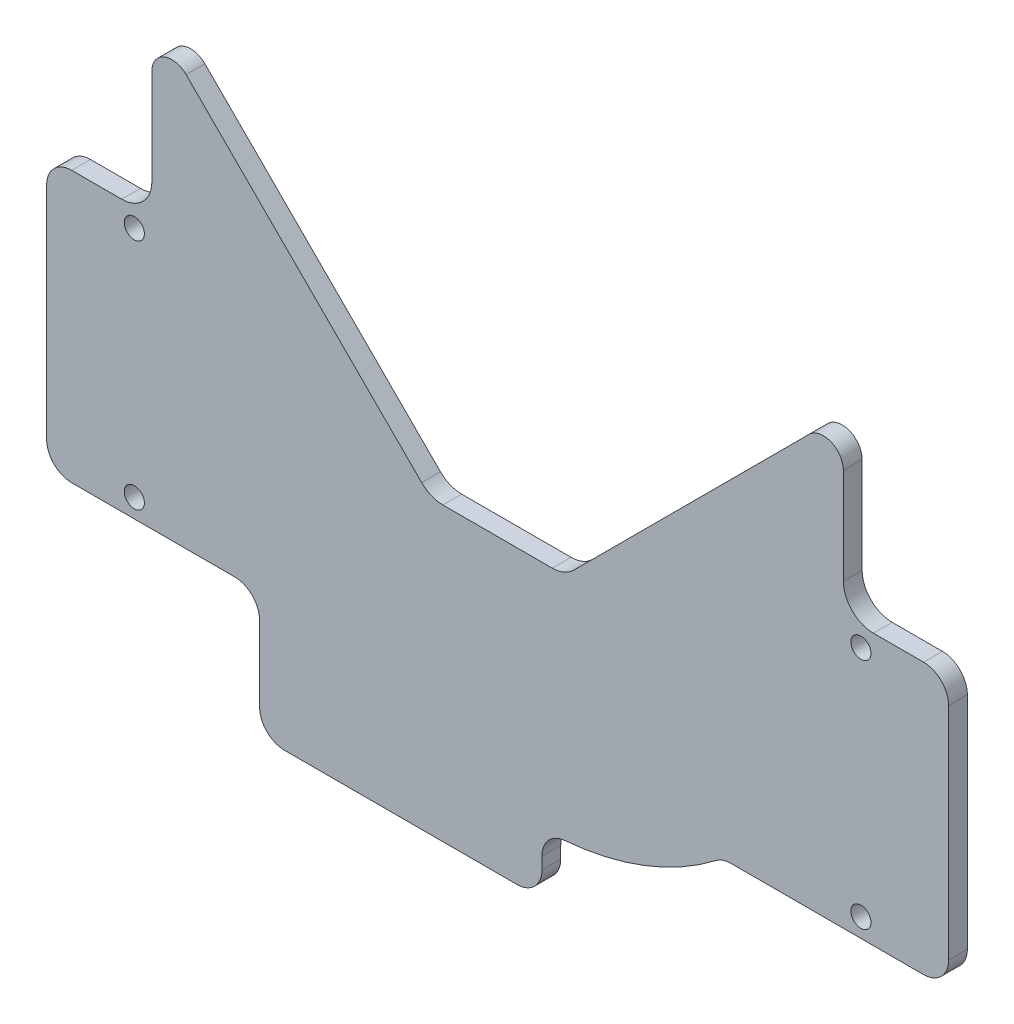
from build123d import *

# Parameters (mm, degrees)
SKETCH2_W                  = 228.6
SKETCH2_H                  = 165.1
BOSS_EXTRUDE1_DEPTH        = 4.7625
F_1_2_0_5_DIAMETER_HOLE1_D = 25.4
SKETCH7_R                  = 66.675
CUT_EXTRUDE4_DEPTH         = 169.123203057
FILLET1_R                  = 6.35
CUT_EXTRUDE5_DEPTH         = 169.123203057
FILLET2_R                  = 6.35
SKETCH9_R                  = 2.5527
CUT_EXTRUDE6_DEPTH         = 149.980700263


with BuildPart() as part:
    # Sketch2 → Boss-Extrude1 (new body)
    with BuildSketch(Plane.XY):
        with Locations((0, 40.65)):
            Rectangle(SKETCH2_W, SKETCH2_H)
    extrude(amount=BOSS_EXTRUDE1_DEPTH)

    # 1/2 (0.5) Diameter Hole1 (through all)
    with Locations(Plane.XY.offset(4.7625)):
        with Locations((-38.227, 85.227), (38.227, 85.227), (11.2268, 45.984)):
            Hole(F_1_2_0_5_DIAMETER_HOLE1_D / 2)

    # Sketch7 → Cut-Extrude4 (cut, through all)
    with BuildSketch(Plane(origin=(0, 0, 0), x_dir=(-1, 0, 0), z_dir=(0, 0, -1))):
        with Locations((0, 180.35)):
            Circle(SKETCH7_R)
    extrude(amount=-CUT_EXTRUDE4_DEPTH, mode=Mode.SUBTRACT)

    # Fillet1
    fillet1_edges = [part.edges().sort_by_distance(p)[0] for p in [
        (-114.3, -41.9, 2.38125),
        (114.3, -41.9, 2.38125),
        (114.3, 123.2, 2.38125),
        (-114.3, 123.2, 2.38125),
    ]]
    fillet(fillet1_edges, radius=FILLET1_R)

    # Sketch8 → Cut-Extrude5 (cut, through all)
    with BuildSketch(Plane.XY.offset(4.7625)):
        with BuildLine():
            Line((-107.95, -41.9), (-60.325, -41.9))
            Line((-60.325, -41.9), (-60.325, -10.15))
            Line((-60.325, -10.15), (-114.3, -10.15))
            Line((-114.3, -10.15), (-114.3, -35.55))
            ThreePointArc((-114.3, -35.55), (-112.440128061, -40.040128061), (-107.95, -41.9))
        make_face()
        with BuildLine():
            Line((11.2395, -41.9), (11.2395, -26.403482524))
            ThreePointArc((11.2395, -26.403482524), (35.494289217, -22.219180967), (56.945117879, -10.15))
            Line((56.945117879, -10.15), (114.3, -10.15))
            Line((114.3, -10.15), (114.3, -35.55))
            ThreePointArc((114.3, -35.55), (112.440128061, -40.040128061), (107.95, -41.9))
            Line((107.95, -41.9), (11.2395, -41.9))
        make_face()
        with BuildLine():
            Line((-114.3, 58.43), (-95.25, 58.43))
            ThreePointArc((-95.25, 58.43), (-89.861846327, 60.661846327), (-87.63, 66.05))
            Line((-87.63, 66.05), (-87.63, 90.356249112))
            ThreePointArc((-87.63, 90.356249112), (-84.494031836, 95.049557138), (-78.957897552, 93.948351561))
            Line((-78.957897552, 93.948351561), (-19.257909794, 34.248363803))
            ThreePointArc((-19.257909794, 34.248363803), (-16.785803876, 32.596555438), (-13.869756121, 32.016517476))
            Line((-13.869756121, 32.016517476), (13.869756121, 32.016517476))
            ThreePointArc((13.869756121, 32.016517476), (16.785803876, 32.596555438), (19.257909794, 34.248363803))
            Line((19.257909794, 34.248363803), (78.957897552, 93.948351561))
            ThreePointArc((78.957897552, 93.948351561), (84.494031836, 95.049557138), (87.63, 90.356249112))
            Line((87.63, 90.356249112), (87.63, 66.05))
            ThreePointArc((87.63, 66.05), (89.861846327, 60.661846327), (95.25, 58.43))
            Line((95.25, 58.43), (114.3, 58.43))
            Line((114.3, 58.43), (114.3, 163.646139438))
            Line((114.3, 163.646139438), (-114.3, 163.646139438))
            Line((-114.3, 163.646139438), (-114.3, 58.43))
        make_face()
    extrude(amount=-CUT_EXTRUDE5_DEPTH, mode=Mode.SUBTRACT)

    # Fillet2
    fillet2_edges = [part.edges().sort_by_distance(p)[0] for p in [
        (114.3, -10.15, 2.38125),
        (56.945117879, -10.15, 2.38125),
        (11.2395, -26.403482524, 2.38125),
        (-60.325, -10.15, 2.38125),
        (-114.3, -10.15, 2.38125),
        (-60.325, -41.9, 2.38125),
        (11.2395, -41.9, 2.38125),
        (114.3, 58.43, 2.38125),
        (-114.3, 58.43, 2.38125),
    ]]
    fillet(fillet2_edges, radius=FILLET2_R)

    # Sketch9 → Cut-Extrude6 (cut, through all)
    with BuildSketch(Plane.XY.offset(4.7625)):
        with Locations((-92.075, 53.6675)):
            Circle(SKETCH9_R)
        with Locations((92.075, 53.6675)):
            Circle(SKETCH9_R)
        with Locations((92.075, -5.3875)):
            Circle(SKETCH9_R)
        with Locations((-92.075, -5.3875)):
            Circle(SKETCH9_R)
    extrude(amount=-CUT_EXTRUDE6_DEPTH, mode=Mode.SUBTRACT)


solid = part.part
